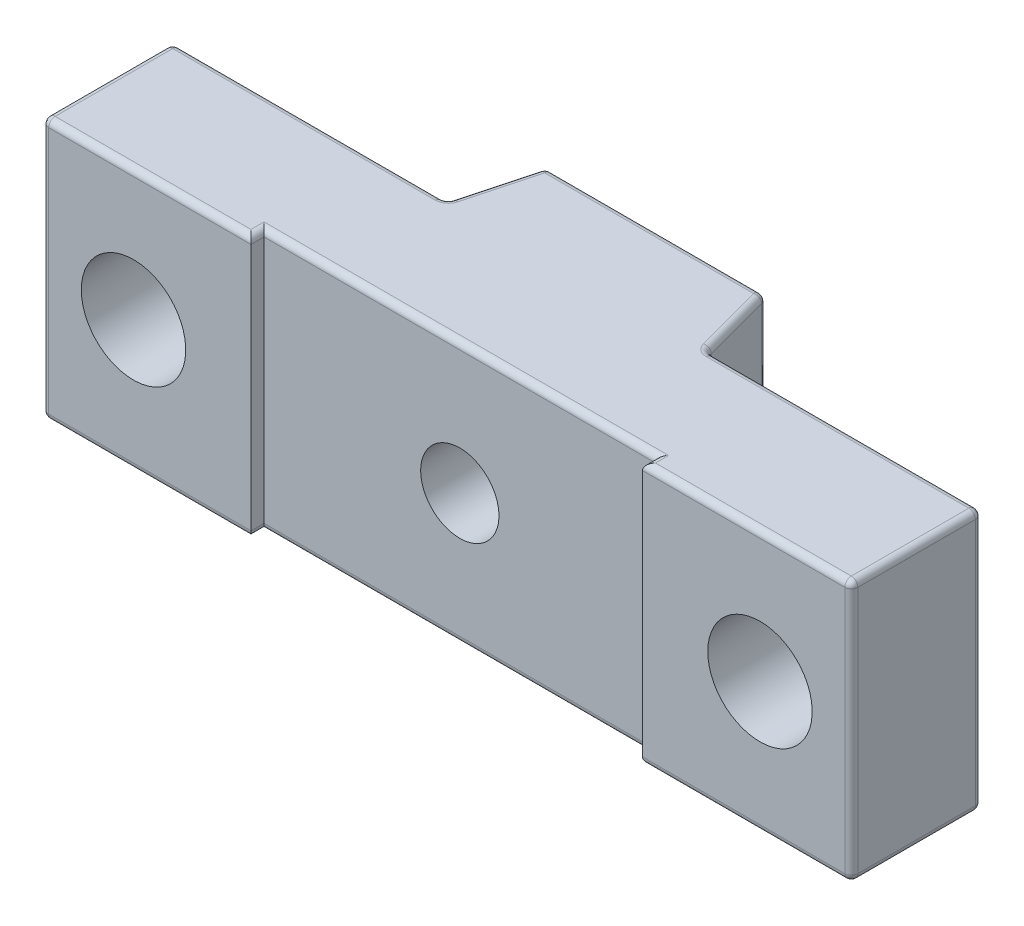
from build123d import *

# Parameters (mm, degrees)
BOSS_EXTRUDE1_DEPTH = 5
SKETCH2_W           = 15
SKETCH2_H           = 0.5
CUT_EXTRUDE1_DEPTH  = 20.248376555
SKETCH3_R           = 1.5
SKETCH3_R_2         = 2
CUT_EXTRUDE2_DEPTH  = 18.036725037
SKETCH4_R           = 1.5
CUT_EXTRUDE3_DEPTH  = 19.145247312
FILLET1_R           = 0.25


with BuildPart() as part:
    # Sketch1 → Boss-Extrude1 (new, symmetric)
    with BuildSketch(Plane(origin=(0, 0, 0), x_dir=(1, 0, 0), z_dir=(0, 1, 0))):
        Polygon((-5, 2.5), (-4.196152423, 5.5), (4.196152423, 5.5), (5, 2.5), (15.5, 2.5), (15.5, -2.5), (-15.5, -2.5), (-15.5, 2.5), align=None)
    extrude(amount=BOSS_EXTRUDE1_DEPTH, both=True)

    # Sketch2 → Cut-Extrude1 (cut, through all)
    with BuildSketch(Plane(origin=(0, 5, 0), x_dir=(1, 0, 0), z_dir=(0, 1, 0))):
        with Locations((0, -2.25)):
            Rectangle(SKETCH2_W, SKETCH2_H)
    extrude(amount=-CUT_EXTRUDE1_DEPTH, mode=Mode.SUBTRACT)

    # Sketch3 → Cut-Extrude2 (cut, through all)
    with BuildSketch(Plane(origin=(0, 0, -2.5), x_dir=(-1, 0, 0), z_dir=(0, 0, -1))):
        Circle(SKETCH3_R)
        with Locations((12, 0)):
            Circle(SKETCH3_R_2)
        with Locations((-12, 0)):
            Circle(SKETCH3_R_2)
    extrude(amount=-CUT_EXTRUDE2_DEPTH, mode=Mode.SUBTRACT)

    # Sketch4 → Cut-Extrude3 (cut, through all)
    with BuildSketch(Plane(origin=(0, 0, -5.5), x_dir=(-1, 0, 0), z_dir=(0, 0, -1))):
        Circle(SKETCH4_R)
    extrude(amount=-CUT_EXTRUDE3_DEPTH, mode=Mode.SUBTRACT)

    # Fillet1
    fillet1_edges = [part.edges().sort_by_distance(p)[0] for p in [
        (15.5, -5, 0),
        (-11.5, -5, 2.5),
        (-15.5, -5, 0),
        (-10.25, -5, -2.5),
        (-11.5, 5, 2.5),
        (-5, 0, -2.5),
        (-4.196152423, 0, -5.5),
        (4.196152423, 0, -5.5),
        (5, 0, -2.5),
        (15.5, 0, -2.5),
        (15.5, 0, 2.5),
        (-15.5, 0, 2.5),
        (-15.5, 0, -2.5),
        (15.5, 5, 0),
        (10.25, 5, -2.5),
        (4.598076211, 5, -4),
        (11.5, -5, 2.5),
        (11.5, 5, 2.5),
        (0, 5, -5.5),
        (-7.5, -5, 2.25),
        (0, -5, 2),
        (7.5, -5, 2.25),
        (-7.5, 5, 2.25),
        (-4.598076211, 5, -4),
        (7.5, 5, 2.25),
        (0, 5, 2),
        (-10.25, 5, -2.5),
        (-4.598076211, -5, -4),
        (-15.5, 5, 0),
        (0, -5, -5.5),
        (4.598076211, -5, -4),
        (10.25, -5, -2.5),
    ]]
    fillet(fillet1_edges, radius=FILLET1_R)


solid = part.part
